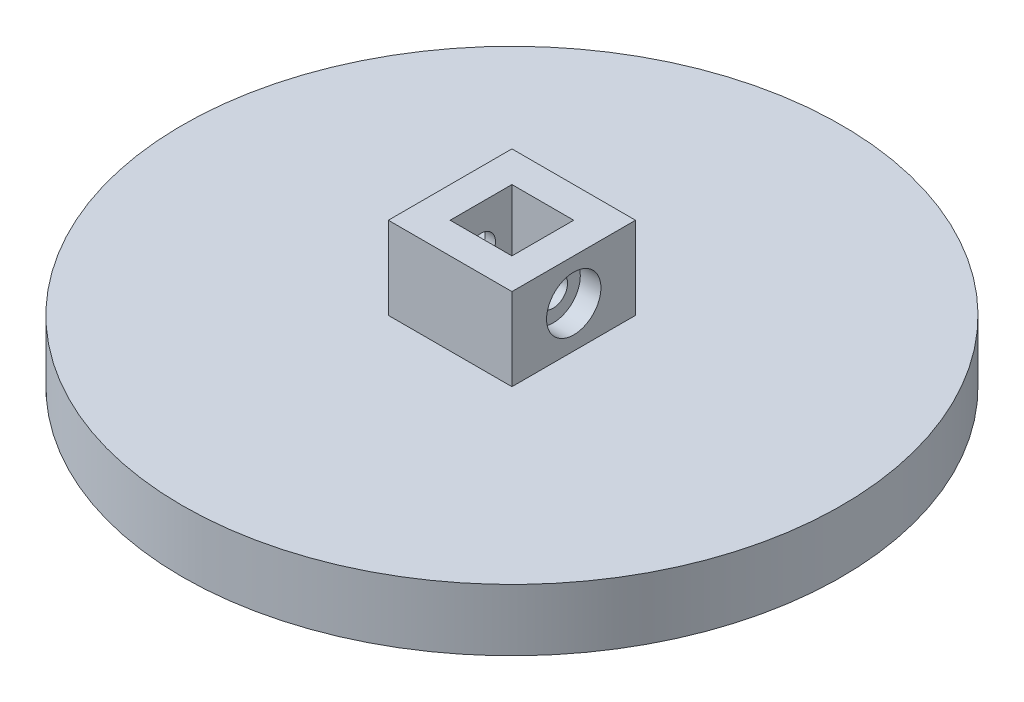
from build123d import *

# Parameters (mm, degrees)
SKETCH1_R           = 40
BOSS_EXTRUDE1_DEPTH = 7.5
SKETCH2_W           = 15
SKETCH2_H           = 15
BOSS_EXTRUDE2_DEPTH = 10
SKETCH3_R           = 1.75
CUT_EXTRUDE1_DEPTH  = 15
SKETCH4_R           = 3.3
CUT_EXTRUDE2_DEPTH  = 2.5
CUT_EXTRUDE3_DEPTH  = 2.5
SKETCH6_W           = 7.5
SKETCH6_H           = 7.5
CUT_EXTRUDE4_DEPTH  = 17.5


with BuildPart() as part:
    # Sketch1 → Boss-Extrude1 (new body)
    with BuildSketch(Plane(origin=(0, 0, 0), x_dir=(1, 0, 0), z_dir=(0, 1, 0))):
        with Locations(Location((0, 0, 0), (0, 0, 270))):
            Circle(SKETCH1_R)
    extrude(amount=BOSS_EXTRUDE1_DEPTH)

    # Sketch2 → Boss-Extrude2 (add)
    with BuildSketch(Plane(origin=(0, 7.5, 0), x_dir=(1, 0, 0), z_dir=(0, 1, 0))):
        Rectangle(SKETCH2_W, SKETCH2_H)
    extrude(amount=BOSS_EXTRUDE2_DEPTH)

    # Sketch3 → Cut-Extrude1 (cut)
    with BuildSketch(Plane(origin=(7.5, 0, 0), x_dir=(0, 0, -1), z_dir=(1, 0, 0))):
        with Locations((0, 12.5)):
            Circle(SKETCH3_R)
    extrude(amount=-CUT_EXTRUDE1_DEPTH, mode=Mode.SUBTRACT)

    # Sketch4 → Cut-Extrude2 (cut)
    with BuildSketch(Plane(origin=(7.5, 0, 0), x_dir=(0, 0, -1), z_dir=(1, 0, 0))):
        with Locations((0, 12.5)):
            Circle(SKETCH4_R)
    extrude(amount=-CUT_EXTRUDE2_DEPTH, mode=Mode.SUBTRACT)

    # Sketch5 → Cut-Extrude3 (cut)
    with BuildSketch(Plane.ZY.offset(7.5)):
        Polygon((-3.35, 12.5), (-1.675, 9.598814897), (1.675, 9.598814897), (3.35, 12.5), (1.675, 15.401185103), (-1.675, 15.401185103), align=None)
    extrude(amount=-CUT_EXTRUDE3_DEPTH, mode=Mode.SUBTRACT)

    # Sketch6 → Cut-Extrude4 (cut)
    with BuildSketch(Plane(origin=(0, 17.5, 0), x_dir=(1, 0, 0), z_dir=(0, 1, 0))):
        Rectangle(SKETCH6_W, SKETCH6_H)
    extrude(amount=-CUT_EXTRUDE4_DEPTH, mode=Mode.SUBTRACT)


solid = part.part
